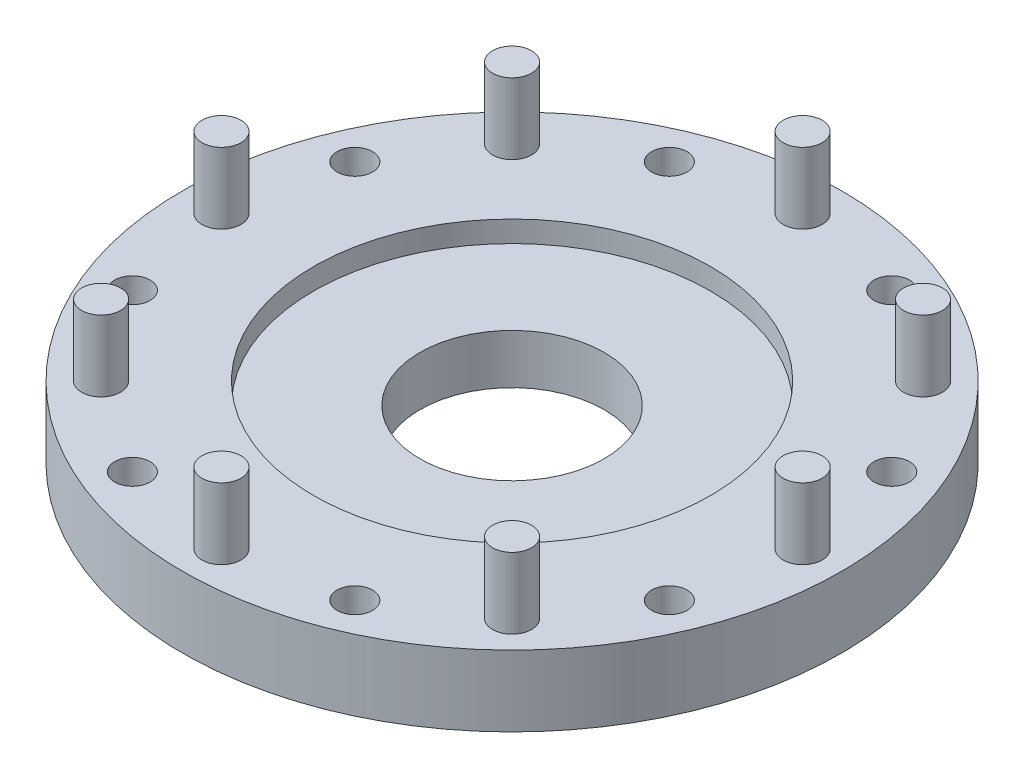
from build123d import *

# Parameters (mm, degrees)
CUT_EXTRUDE1_DEPTH      = 67.516915142
CUT_EXTRUDE1_DEPTH_BACK = 67.516915142
SKETCH2_R               = 2.75
SKETCH2_R_2             = 2.5
SKETCH3_W               = 7
SKETCH3_H               = 4
CUT_EXTRUDE2_DEPTH      = 5
BOSS_EXTRUDE1_START     = -20
SKETCH5_R               = 2.75
BOSS_EXTRUDE1_DEPTH     = 20


with BuildPart() as part:
    # Sketch1 → Revolve1 (revolve)
    with BuildSketch(Plane.XY, mode=Mode.PRIVATE) as revolve1_sk:
        Polygon((-28, 10), (-46.5, 10), (-46.5, 0), (-13, 0), (-13, 7), (-28, 7), align=None)
    revolve(revolve1_sk.sketch.rotate(Axis((0, -1.751877994, 0), (0, 1, 0)), 270), axis=Axis((0, -1.751877994, 0), (0, 1, 0)))

    # Sketch2 → Cut-Extrude1 (cut, two sides: drawn at the far end of the back side and taken through both)
    with BuildSketch(Plane(origin=(0, 10, 0), x_dir=(1, 0, 0), z_dir=(0, 1, 0)).offset(-CUT_EXTRUDE1_DEPTH_BACK)):
        with Locations(Location((0, 41, 0), (0, 0, 270))):
            Circle(SKETCH2_R)
        with Locations(Location((15.690020727, 37.879060833, 0), (0, 0, 270))):
            Circle(SKETCH2_R_2)
        with Locations(Location((28.991378029, 28.991378029, 0), (0, 0, 270))):
            Circle(SKETCH2_R)
        with Locations(Location((37.879060833, 15.690020727, 0), (0, 0, 270))):
            Circle(SKETCH2_R_2)
        with Locations(Location((41, 0, 0), (0, 0, 270))):
            Circle(SKETCH2_R)
        with Locations(Location((37.879060833, -15.690020727, 0), (0, 0, 270))):
            Circle(SKETCH2_R_2)
        with Locations(Location((28.991378029, -28.991378029, 0), (0, 0, 270))):
            Circle(SKETCH2_R)
        with Locations(Location((15.690020727, -37.879060833, 0), (0, 0, 270))):
            Circle(SKETCH2_R_2)
        with Locations(Location((0, -41, 0), (0, 0, 270))):
            Circle(SKETCH2_R)
        with Locations(Location((-15.690020727, -37.879060833, 0), (0, 0, 270))):
            Circle(SKETCH2_R_2)
        with Locations(Location((-28.991378029, -28.991378029, 0), (0, 0, 270))):
            Circle(SKETCH2_R)
        with Locations(Location((-37.879060833, -15.690020727, 0), (0, 0, 270))):
            Circle(SKETCH2_R_2)
        with Locations(Location((-41, 0, 0), (0, 0, 270))):
            Circle(SKETCH2_R)
        with Locations(Location((-37.879060833, 15.690020727, 0), (0, 0, 270))):
            Circle(SKETCH2_R_2)
        with Locations(Location((-28.991378029, 28.991378029, 0), (0, 0, 270))):
            Circle(SKETCH2_R)
        with Locations(Location((-15.690020727, 37.879060833, 0), (0, 0, 270))):
            Circle(SKETCH2_R_2)
    extrude(amount=CUT_EXTRUDE1_DEPTH + CUT_EXTRUDE1_DEPTH_BACK, mode=Mode.SUBTRACT)

    # Sketch3 → Cut-Revolve1 (revolve, cut)
    with BuildSketch(Plane.XY, mode=Mode.PRIVATE) as cut_revolve1_sk:
        with Locations((25, 2)):
            Rectangle(SKETCH3_W, SKETCH3_H)
    revolve(cut_revolve1_sk.sketch.rotate(Axis((0, -19.065406541, 0), (0, 1, 0)), 90), axis=Axis((0, -19.065406541, 0), (0, 1, 0)), mode=Mode.SUBTRACT)

    # Sketch4 → Cut-Extrude2 (cut)
    with BuildSketch(Plane.XZ):
        Polygon((-19.690020727, 40.18846191), (-19.690020727, 35.569659756), (-15.690020727, 33.260258679), (-11.690020727, 35.569659756), (-11.690020727, 40.18846191), (-15.690020727, 42.497862986), align=None)
        Polygon((18.956007051, 41.145047157), (14.494586764, 42.34048112), (11.22860044, 39.074494796), (12.424034403, 34.613074509), (16.88545469, 33.417640546), (20.151441014, 36.68362687), align=None)
        Polygon((42.497862986, 15.690020727), (40.18846191, 19.690020727), (35.569659756, 19.690020727), (33.260258679, 15.690020727), (35.569659756, 11.690020727), (40.18846191, 11.690020727), align=None)
        Polygon((41.145047157, -18.956007051), (42.34048112, -14.494586764), (39.074494796, -11.22860044), (34.613074509, -12.424034403), (33.417640546, -16.88545469), (36.68362687, -20.151441014), align=None)
        Polygon((15.690020727, -42.497862986), (19.690020727, -40.18846191), (19.690020727, -35.569659756), (15.690020727, -33.260258679), (11.690020727, -35.569659756), (11.690020727, -40.18846191), align=None)
        Polygon((-18.956007051, -41.145047157), (-14.494586764, -42.34048112), (-11.22860044, -39.074494796), (-12.424034403, -34.613074509), (-16.88545469, -33.417640546), (-20.151441014, -36.68362687), align=None)
        Polygon((-42.497862986, -15.690020727), (-40.18846191, -19.690020727), (-35.569659756, -19.690020727), (-33.260258679, -15.690020727), (-35.569659756, -11.690020727), (-40.18846191, -11.690020727), align=None)
        Polygon((-41.145047157, 18.956007051), (-42.34048112, 14.494586764), (-39.074494796, 11.22860044), (-34.613074509, 12.424034403), (-33.417640546, 16.88545469), (-36.68362687, 20.151441014), align=None)
    extrude(amount=-CUT_EXTRUDE2_DEPTH, mode=Mode.SUBTRACT)

    # Sketch5 → Boss-Extrude1 (add)
    with BuildSketch(Plane.XZ.offset(BOSS_EXTRUDE1_START)):
        with Locations(Location((0, 41, 0), (0, 0, 270))):
            Circle(SKETCH5_R)
        with Locations(Location((28.991378029, 28.991378029, 0), (0, 0, 270))):
            Circle(SKETCH5_R)
        with Locations(Location((41, 0, 0), (0, 0, 270))):
            Circle(SKETCH5_R)
        with Locations(Location((28.991378029, -28.991378029, 0), (0, 0, 270))):
            Circle(SKETCH5_R)
        with Locations(Location((0, -41, 0), (0, 0, 270))):
            Circle(SKETCH5_R)
        with Locations(Location((-28.991378029, -28.991378029, 0), (0, 0, 270))):
            Circle(SKETCH5_R)
        with Locations(Location((-41, 0, 0), (0, 0, 270))):
            Circle(SKETCH5_R)
        with Locations(Location((-28.991378029, 28.991378029, 0), (0, 0, 270))):
            Circle(SKETCH5_R)
    extrude(amount=BOSS_EXTRUDE1_DEPTH)


solid = part.part
